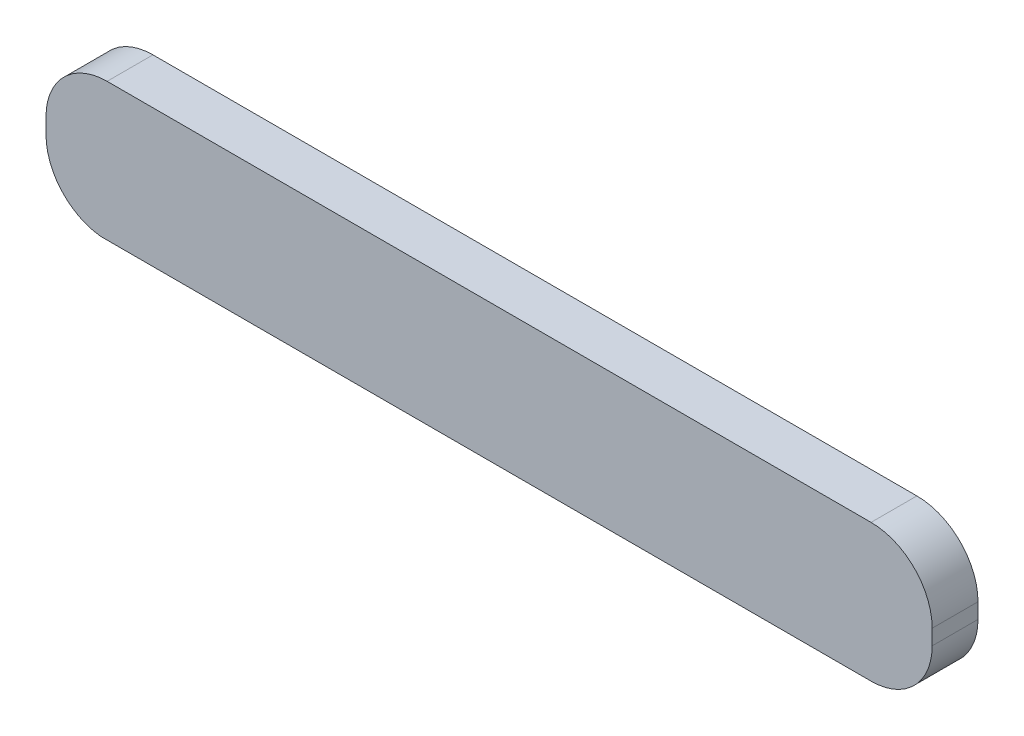
from build123d import *

# Parameters (mm, degrees)
RESSALTO_EXTRUS_O1_DEPTH = 15


with BuildPart() as part:
    # Esboço1 → Ressalto-extrusão1 (new body)
    with BuildSketch(Plane.XY):
        with BuildLine():
            Line((-25, 22.5), (225, 22.5))
            ThreePointArc((225, 22.5), (239.142135624, 16.642135624), (245, 2.5))
            Line((245, 2.5), (245, -2.5))
            ThreePointArc((245, -2.5), (239.142135624, -16.642135624), (225, -22.5))
            Line((225, -22.5), (-27.140462438, -22.5))
            ThreePointArc((-27.140462438, -22.5), (-39.879671515, -15.978827442), (-45, -2.61486936))
            Line((-45, -2.61486936), (-45, 2.5))
            ThreePointArc((-45, 2.5), (-39.142135624, 16.642135624), (-25, 22.5))
        make_face()
    extrude(amount=RESSALTO_EXTRUS_O1_DEPTH)


solid = part.part
